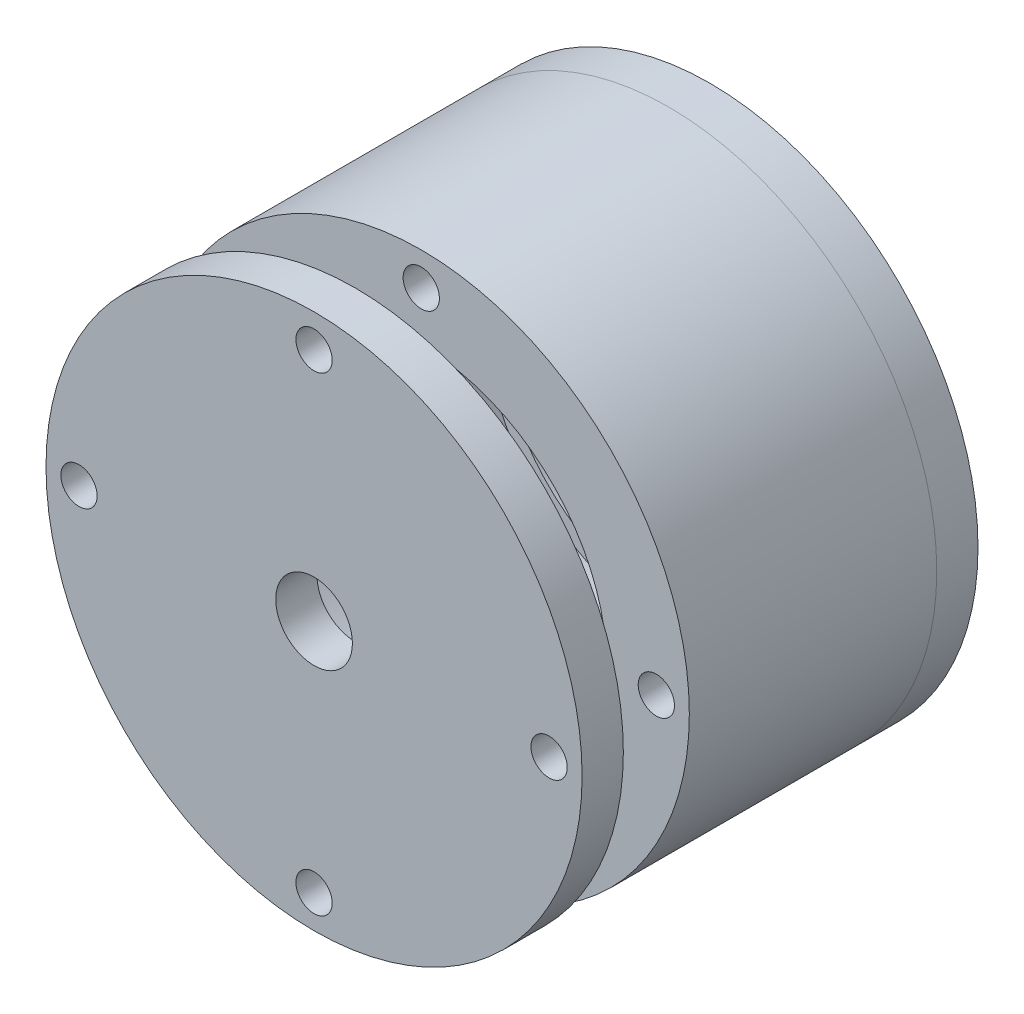
from build123d import *

# Parameters (mm, degrees)
SKETCH2_R               = 32.5
SKETCH2_R_2             = 4.65
SKETCH2_R_3             = 2.2
BOSS_EXTRUDE1_DEPTH     = 5
BOSS_EXTRUDE2_START     = 8
SKETCH3_R               = 32.5
SKETCH3_R_2             = 22.5
SKETCH3_R_3             = 2.2
BOSS_EXTRUDE2_DEPTH     = 30
CUT_EXTRUDE1_DEPTH      = 8
CUT_EXTRUDE1_DEPTH_BACK = 2.5
SKETCH4_R               = 20.6
SKETCH4_R_2             = 15.6
CUT_EXTRUDE2_START      = -2.5
SKETCH5_R               = 20.6
SKETCH5_R_2             = 15.6
CUT_EXTRUDE2_DEPTH      = 2.5


with BuildPart() as part:
    # Sketch2 → Boss-Extrude1 (new body)
    with BuildSketch(Plane.XY):
        with Locations((33.49662103, -33.754772237)):
            Circle(SKETCH2_R)
        with Locations((33.49662103, -33.754772237)):
            Circle(SKETCH2_R_2, mode=Mode.SUBTRACT)
        with Locations((33.49662103, -5.254772237)):
            Circle(SKETCH2_R_3, mode=Mode.SUBTRACT)
        with Locations((4.99662103, -33.754772237)):
            Circle(SKETCH2_R_3, mode=Mode.SUBTRACT)
        with Locations((33.49662103, -62.254772237)):
            Circle(SKETCH2_R_3, mode=Mode.SUBTRACT)
        with Locations((61.99662103, -33.754772237)):
            Circle(SKETCH2_R_3, mode=Mode.SUBTRACT)
    extrude(amount=BOSS_EXTRUDE1_DEPTH)


with BuildPart() as body_2:
    # Sketch3 → Boss-Extrude2 (new body)
    with BuildSketch(Plane(origin=(0, 0, 0), x_dir=(-1, 0, 0), z_dir=(0, 0, -1)).offset(BOSS_EXTRUDE2_START)):
        with Locations((-33.49662103, -33.754772237)):
            Circle(SKETCH3_R)
        with Locations((-33.49662103, -33.754772237)):
            Circle(SKETCH3_R_2, mode=Mode.SUBTRACT)
        with Locations((-33.49662103, -5.254772237)):
            Circle(SKETCH3_R_3, mode=Mode.SUBTRACT)
        with Locations((-4.99662103, -33.754772237)):
            Circle(SKETCH3_R_3, mode=Mode.SUBTRACT)
        with Locations((-33.49662103, -62.254772237)):
            Circle(SKETCH3_R_3, mode=Mode.SUBTRACT)
        with Locations((-61.99662103, -33.754772237)):
            Circle(SKETCH3_R_3, mode=Mode.SUBTRACT)
    extrude(amount=BOSS_EXTRUDE2_DEPTH)


with BuildPart() as body_3:
    # Mirror1: mirrored copy
    add(part.part.mirror(Plane(origin=(0, 0, -19), x_dir=(1, 0, 0), z_dir=(0, 0, -1))))

    # Sketch5 → Cut-Extrude2 (cut)
    with BuildSketch(Plane.XY.offset(-38).offset(CUT_EXTRUDE2_START)):
        with Locations((33.49662103, -33.754772237)):
            Circle(SKETCH5_R)
        with Locations((33.49662103, -33.754772237)):
            Circle(SKETCH5_R_2, mode=Mode.SUBTRACT)
    extrude(amount=CUT_EXTRUDE2_DEPTH, mode=Mode.SUBTRACT)


with BuildPart() as part_1:
    add(part.part)

    # Sketch4 → Cut-Extrude1 (cut, two sides: drawn at the far end of the back side and taken through both)
    with BuildSketch(Plane(origin=(0, 0, 0), x_dir=(-1, 0, 0), z_dir=(0, 0, -1)).offset(-CUT_EXTRUDE1_DEPTH_BACK)):
        with Locations(Location((-33.49662103, -33.754772237, 0), (0, 0, 180))):
            Circle(SKETCH4_R)
        with Locations(Location((-33.49662103, -33.754772237, 0), (0, 0, 180))):
            Circle(SKETCH4_R_2, mode=Mode.SUBTRACT)
    extrude(amount=CUT_EXTRUDE1_DEPTH + CUT_EXTRUDE1_DEPTH_BACK, mode=Mode.SUBTRACT)


solid = Compound([body_2.part, body_3.part, part_1.part])
